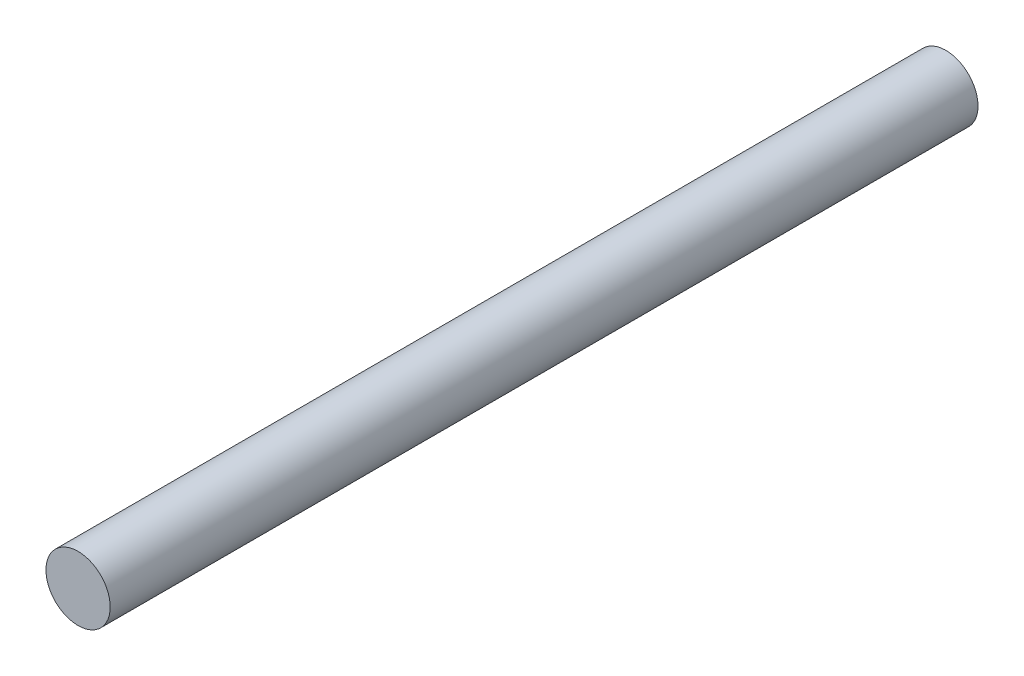
from build123d import *

# Parameters (mm, degrees)
CROQUIS1_R              = 10
SALIENTE_EXTRUIR1_DEPTH = 270


with BuildPart() as part:
    # Croquis1 → Saliente-Extruir1 (new body)
    with BuildSketch(Plane.XY):
        Circle(CROQUIS1_R)
    extrude(amount=SALIENTE_EXTRUIR1_DEPTH)


solid = part.part
